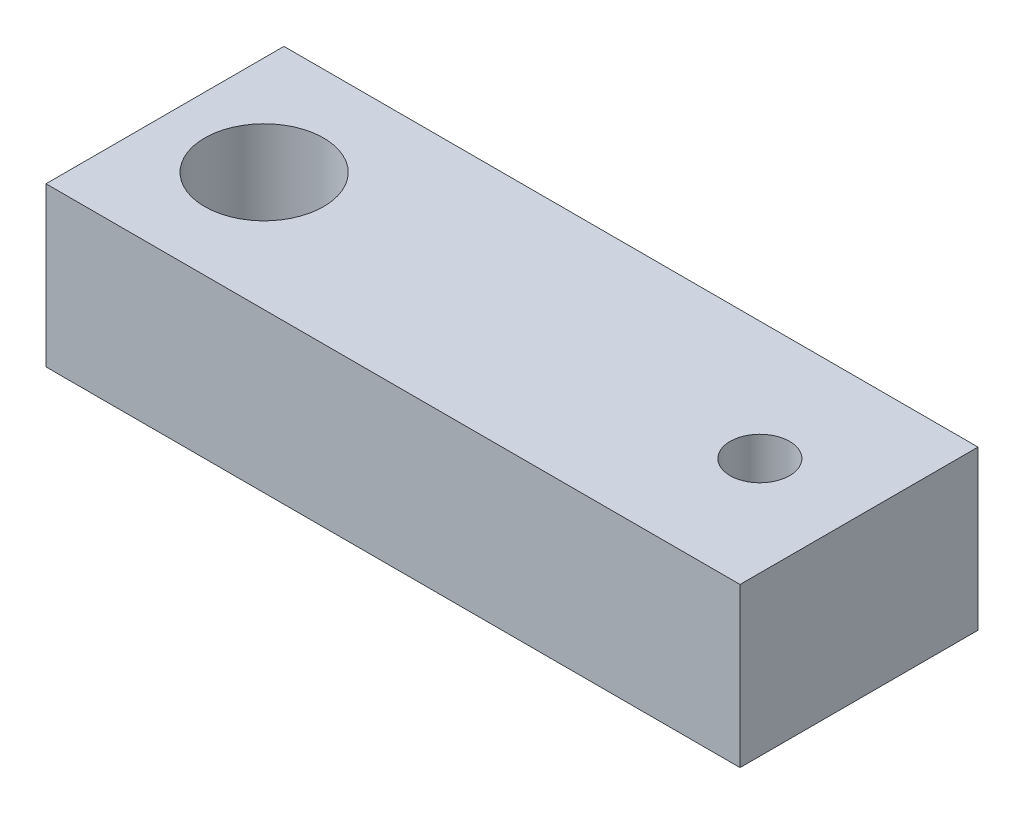
from build123d import *

# Parameters (mm, degrees)
SKETCH2_W           = 35
SKETCH2_H           = 12
SKETCH2_R           = 3
SKETCH2_R_2         = 1.5
BOSS_EXTRUDE1_DEPTH = 8


with BuildPart() as part:
    # Sketch2 → Boss-Extrude1 (new body)
    with BuildSketch(Plane(origin=(0, 0, 0), x_dir=(1, 0, 0), z_dir=(0, 1, 0))):
        with Locations((17.5, 6)):
            Rectangle(SKETCH2_W, SKETCH2_H)
        with Locations(Location((5, 6, 0), (0, 0, 270))):
            Circle(SKETCH2_R, mode=Mode.SUBTRACT)
        with Locations(Location((30, 6, 0), (0, 0, 270))):
            Circle(SKETCH2_R_2, mode=Mode.SUBTRACT)
    extrude(amount=BOSS_EXTRUDE1_DEPTH)


solid = part.part
